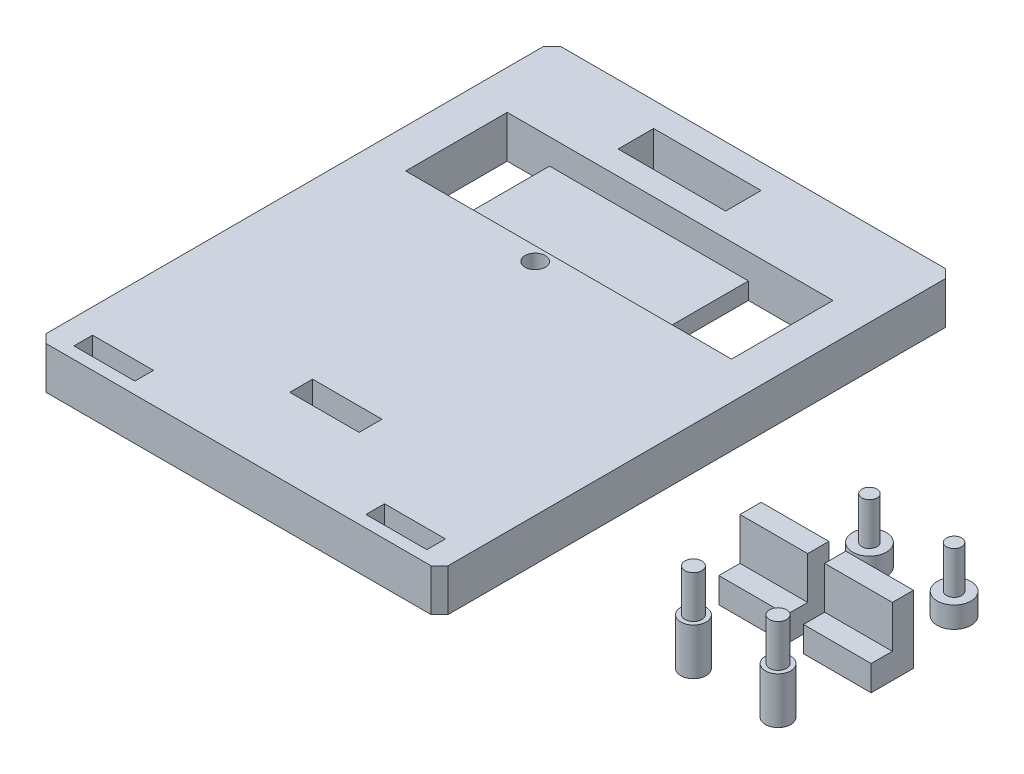
from build123d import *

# Parameters (mm, degrees)
SKETCH_1_W             = 47.5
SKETCH_1_H             = 60.8
EXTRUDE_1_DEPTH        = 5
SKETCH_2_W             = 38.5
SKETCH_2_H             = 12
CUT_EXTRUDE_1_DEPTH    = 3
SKETCH_3_W             = 5
SKETCH_3_H             = 12
SKETCH_3_W_2           = 10
CUT_EXTRUDE_2_DEPTH    = 2
SKETCH_5_R             = 2
EXTRUDE_2_DEPTH        = 2.5
SKETCH_5_3_R           = 1.5
EXTRUDE_3_DEPTH        = 5.5
SKETCH_6_R             = 1.2
CUT_EXTRUDE_4_DEPTH    = 5
SKETCH_7_R             = 0.9
EXTRUDE_4_DEPTH        = 5
SKETCH_8_R             = 1
EXTRUDE_5_DEPTH        = 5
SKETCH_9_W             = 8.2
SKETCH_9_H             = 2.7
CUT_EXTRUDE_5_DEPTH    = 5
CHAMFER_1_SIZE         = 1
SKETCH_10_W            = 12.7
SKETCH_10_H            = 4.2
SKETCH_10_W_2          = 7.2
SKETCH_10_H_2          = 2.2
CUT_EXTRUDE_6_DEPTH    = 5
SKETCH_5_4_W           = 8
SKETCH_5_4_H           = 5
EXTRUDE_6_DEPTH        = 3
SKETCH_11_W            = 8
SKETCH_11_H            = 2.5
EXTRUDE_7_DEPTH        = 5
PATTERN_LINEAR_1_COUNT = 2
PATTERN_LINEAR_1_PITCH = 10


with BuildPart() as part:
    # 草图1 → 凸台-拉伸1 (new body)
    with BuildSketch(Plane(origin=(0, 0, 0), x_dir=(1, 0, 0), z_dir=(0, 1, 0))):
        with Locations((-30.655286344, 2.938237127)):
            Rectangle(SKETCH_1_W, SKETCH_1_H)
    extrude(amount=-EXTRUDE_1_DEPTH)

    # 草图2 → 切除-拉伸1 (cut)
    with BuildSketch(Plane(origin=(0, 0, 0), x_dir=(1, 0, 0), z_dir=(0, 1, 0))):
        with Locations((-30.555286344, 17.438237127)):
            Rectangle(SKETCH_2_W, SKETCH_2_H)
    extrude(amount=-CUT_EXTRUDE_1_DEPTH, mode=Mode.SUBTRACT)

    # 草图3 → 切除-拉伸2 (cut)
    with BuildSketch(Plane(origin=(0, -3, 0), x_dir=(1, 0, 0), z_dir=(0, 1, 0))):
        with Locations((-47.305286344, 17.438237127)):
            Rectangle(SKETCH_3_W, SKETCH_3_H)
        with Locations((-16.305286344, 17.438237127)):
            Rectangle(SKETCH_3_W_2, SKETCH_3_H)
    extrude(amount=-CUT_EXTRUDE_2_DEPTH, mode=Mode.SUBTRACT)

    # 草图6 → 切除-拉伸4 (cut)
    with BuildSketch(Plane(origin=(0, 0, 0), x_dir=(1, 0, 0), z_dir=(0, 1, 0))):
        with Locations((-32.905286344, 9.838237127)):
            Circle(SKETCH_6_R)
    extrude(amount=-CUT_EXTRUDE_4_DEPTH, mode=Mode.SUBTRACT)

    # 草图9 → 切除-拉伸5 (cut)
    with BuildSketch(Plane(origin=(0, 0, 0), x_dir=(1, 0, 0), z_dir=(0, 1, 0))):
        with Locations((-29.905286344, -16.711762873)):
            Rectangle(SKETCH_9_W, SKETCH_9_H)
    extrude(amount=-CUT_EXTRUDE_5_DEPTH, mode=Mode.SUBTRACT)

    # 倒角1
    chamfer_1_edges = [part.edges().sort_by_distance(p)[0] for p in [
        (-54.405286344, -2.5, 27.461762873),
        (-54.405286344, -2.5, -33.338237127),
        (-6.905286344, -2.5, -33.338237127),
        (-6.905286344, -2.5, 27.461762873),
    ]]
    chamfer(chamfer_1_edges, length=CHAMFER_1_SIZE)

    # 草图10 → 切除-拉伸6 (cut)
    with BuildSketch(Plane(origin=(0, 0, 0), x_dir=(1, 0, 0), z_dir=(0, 1, 0))):
        with Locations((-33.155286344, 28.338237127)):
            Rectangle(SKETCH_10_W, SKETCH_10_H)
        with Locations((-47.905286344, -24.961762873)):
            Rectangle(SKETCH_10_W_2, SKETCH_10_H_2)
        with Locations((-13.405286344, -24.961762873)):
            Rectangle(SKETCH_10_W_2, SKETCH_10_H_2)
    extrude(amount=-CUT_EXTRUDE_6_DEPTH, mode=Mode.SUBTRACT)


with BuildPart() as body_2:
    # 草图5 → 凸台-拉伸2 (new body)
    with BuildSketch(Plane.XZ.offset(5)):
        with Locations((13.094713656, -3.338237127)):
            Circle(SKETCH_5_R)
    extrude(amount=-EXTRUDE_2_DEPTH)

    # 草图7 → 凸台-拉伸4 (add)
    with BuildSketch(Plane(origin=(0, -2.5, 0), x_dir=(1, 0, 0), z_dir=(0, 1, 0))):
        with Locations((13.094713656, 3.338237127)):
            Circle(SKETCH_7_R)
    extrude(amount=EXTRUDE_4_DEPTH)


with BuildPart() as body_3:
    # 草图5<3> → 凸台-拉伸3 (new body)
    with BuildSketch(Plane.XZ.offset(5)):
        with Locations((13.094713656, 17.461762873)):
            Circle(SKETCH_5_3_R)
    extrude(amount=-EXTRUDE_3_DEPTH)

    # 草图8 → 凸台-拉伸5 (add)
    with BuildSketch(Plane(origin=(0, 0.5, 0), x_dir=(1, 0, 0), z_dir=(0, 1, 0))):
        with Locations((13.094713656, -17.461762873)):
            Circle(SKETCH_8_R)
    extrude(amount=EXTRUDE_5_DEPTH)


with BuildPart() as body_4:
    # 草图5<4> → 凸台-拉伸6 (new body)
    with BuildSketch(Plane.XZ.offset(5)):
        with Locations((12.094713656, 6.961762873)):
            Rectangle(SKETCH_5_4_W, SKETCH_5_4_H)
    extrude(amount=-EXTRUDE_6_DEPTH)

    # 草图11 → 凸台-拉伸7 (add)
    with BuildSketch(Plane(origin=(0, -2, 0), x_dir=(1, 0, 0), z_dir=(0, 1, 0))):
        with Locations((12.094713656, -5.711762873)):
            Rectangle(SKETCH_11_W, SKETCH_11_H)
    extrude(amount=EXTRUDE_7_DEPTH)


with BuildPart() as pattern_linear_1_1:
    # 阵列(线性)1: pattern copy
    add(body_4.part.moved(Location(Vector(1, 0, 0) * (1 * PATTERN_LINEAR_1_PITCH))))


with BuildPart() as pattern_linear_1_2:
    # 阵列(线性)1: pattern copy
    add(body_2.part.moved(Location(Vector(1, 0, 0) * (1 * PATTERN_LINEAR_1_PITCH))))


with BuildPart() as pattern_linear_1_3:
    # 阵列(线性)1: pattern copy
    add(body_3.part.moved(Location(Vector(1, 0, 0) * (1 * PATTERN_LINEAR_1_PITCH))))


solid = Compound([part.part, body_2.part, body_3.part, body_4.part, pattern_linear_1_1.part, pattern_linear_1_2.part, pattern_linear_1_3.part])
